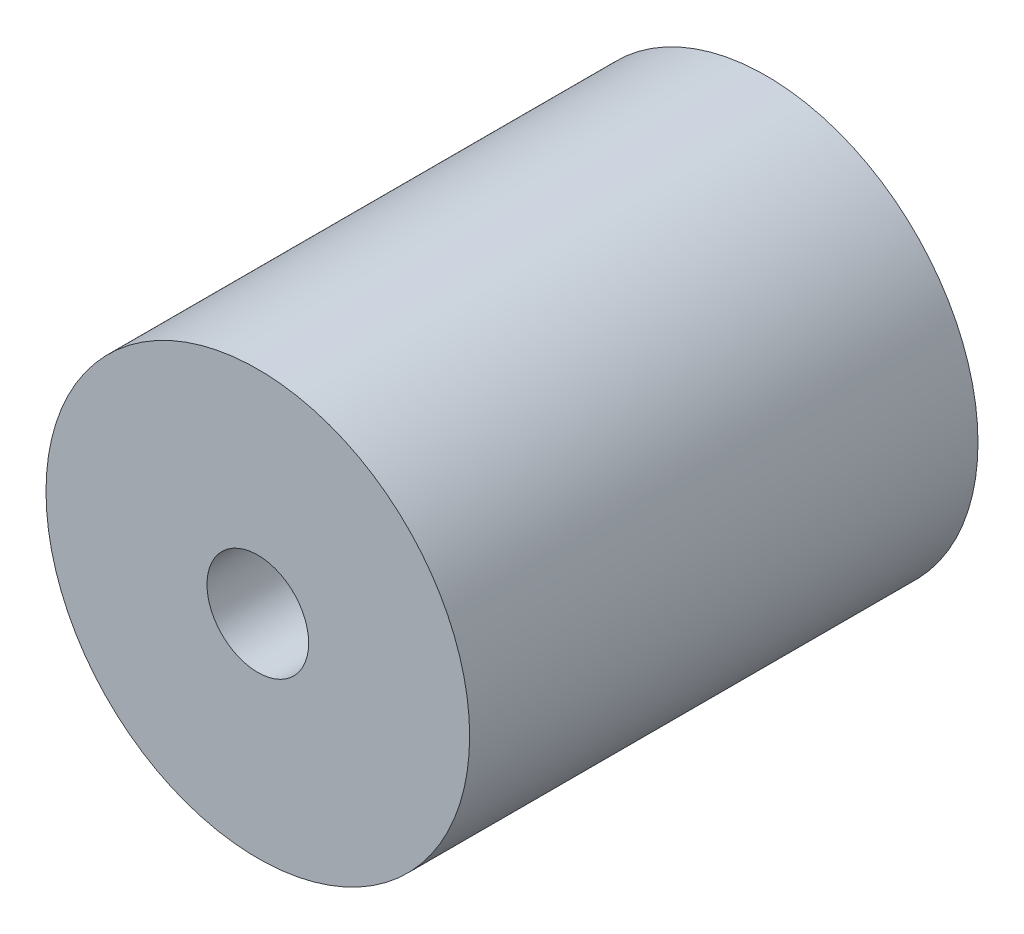
from build123d import *

# Parameters (mm, degrees)
BOSS_EXTRUDE1_DEPTH      = 19.05
BOSS_EXTRUDE1_DEPTH_BACK = 19.05
SKETCH1_R                = 15.875
SKETCH1_R_2              = 3.81


with BuildPart() as part:
    # Sketch1 → Boss-Extrude1 (new, two sides: drawn at the far end of the back side and taken through both)
    with BuildSketch(Plane.XY.offset(-BOSS_EXTRUDE1_DEPTH_BACK)):
        Circle(SKETCH1_R)
        Circle(SKETCH1_R_2, mode=Mode.SUBTRACT)
    extrude(amount=BOSS_EXTRUDE1_DEPTH + BOSS_EXTRUDE1_DEPTH_BACK)


solid = part.part
